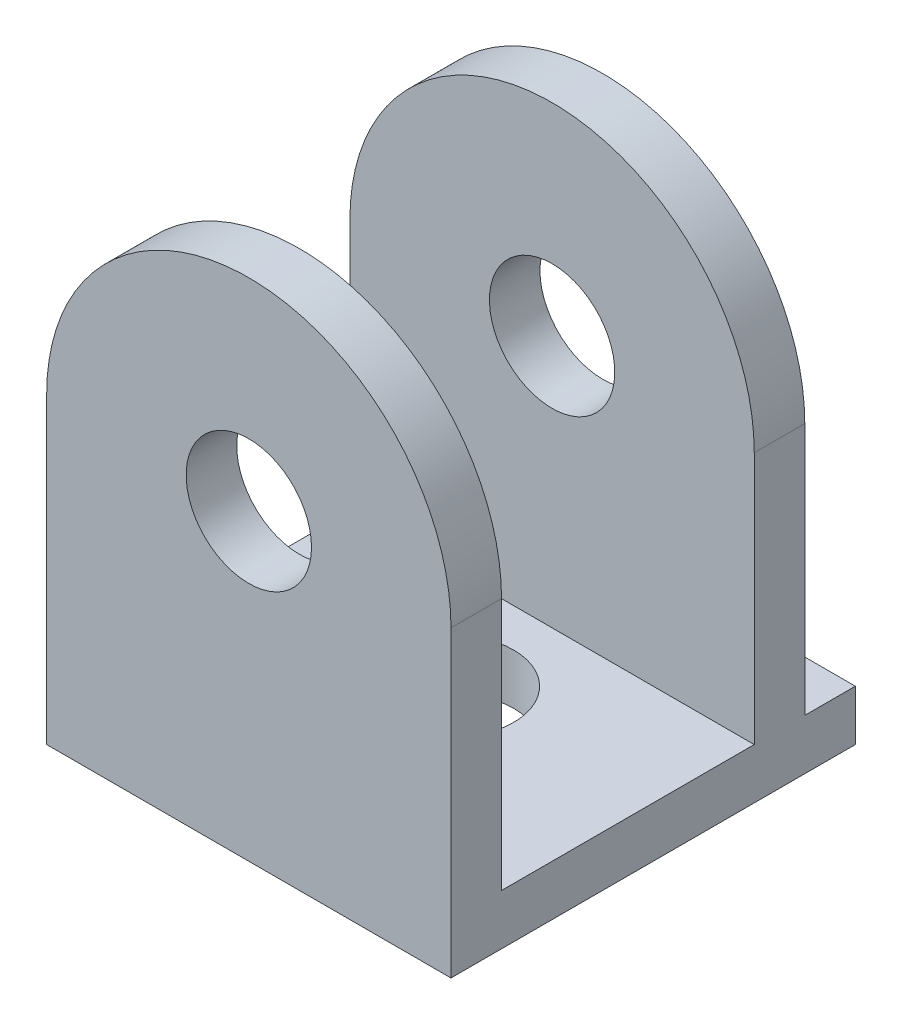
from build123d import *

# Parameters (mm, degrees)
SKETCH1_W               = 20
SKETCH1_H               = 15
BOSS_EXTRUDE1_DEPTH     = 10
CUT_EXTRUDE1_DEPTH      = 29.722813233
CUT_EXTRUDE1_DEPTH_BACK = 29.722813233
SKETCH2_W               = 12.5
SKETCH2_H               = 22.5
SKETCH2_W_2             = 2.5
CUT_EXTRUDE2_DEPTH      = 34.541019662
CUT_EXTRUDE2_DEPTH_BACK = 34.541019662
SKETCH3_R               = 3.1
SKETCH4_R               = 3.1
CUT_EXTRUDE3_DEPTH      = 29.722813233


with BuildPart() as part:
    # Sketch1 → Boss-Extrude1 (new, symmetric)
    with BuildSketch(Plane.XY):
        with BuildLine():
            ThreePointArc((-10, 15), (0, 25), (10, 15))
            Line((10, 15), (-10, 15))
        make_face()
        with Locations((0, 7.5)):
            Rectangle(SKETCH1_W, SKETCH1_H)
    extrude(amount=BOSS_EXTRUDE1_DEPTH, both=True)

    # Sketch2 → Cut-Extrude1 (cut, two sides: drawn at the far end of the back side and taken through both)
    with BuildSketch(Plane(origin=(0, 0, 0), x_dir=(0, 0, -1), z_dir=(1, 0, 0)).offset(-CUT_EXTRUDE1_DEPTH_BACK)):
        with Locations((-1.25, 13.75)):
            Rectangle(SKETCH2_W, SKETCH2_H)
        with Locations((8.75, 13.75)):
            Rectangle(SKETCH2_W_2, SKETCH2_H)
    extrude(amount=CUT_EXTRUDE1_DEPTH + CUT_EXTRUDE1_DEPTH_BACK, mode=Mode.SUBTRACT)

    # Sketch3 → Cut-Extrude2 (cut, two sides: drawn at the far end of the back side and taken through both)
    with BuildSketch(Plane.XY.offset(10).offset(-CUT_EXTRUDE2_DEPTH_BACK)):
        with Locations(Location((0, 15, 0), (0, 0, 90))):
            Circle(SKETCH3_R)
    extrude(amount=CUT_EXTRUDE2_DEPTH + CUT_EXTRUDE2_DEPTH_BACK, mode=Mode.SUBTRACT)

    # Sketch4 → Cut-Extrude3 (cut, through all)
    with BuildSketch(Plane.XZ):
        with Locations(Location((0, 0, 0), (0, 0, 270))):
            Circle(SKETCH4_R)
    extrude(amount=-CUT_EXTRUDE3_DEPTH, mode=Mode.SUBTRACT)


solid = part.part
